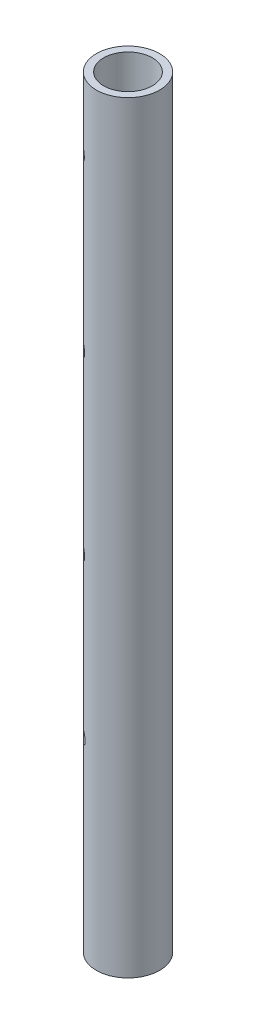
from build123d import *

# Parameters (mm, degrees)
SKETCH2_R                              = 16.51
BOSS_EXTRUDE1_DEPTH                    = 398.018
SKETCH3_R                              = 12.7
CUT_EXTRUDE1_DEPTH                     = 398.018
A_0_234_DIAMETER_HOLE1_REACH           = 365.847
A_0_234_DIAMETER_HOLE1_BORE_R          = 2.9718
A_0_234_DIAMETER_HOLE1_ON_FACE_2_REACH = 278.276
A_0_234_DIAMETER_HOLE1_BORE_2_R        = 2.9718
A_0_234_DIAMETER_HOLE1_ON_FACE_3_REACH = 303.949
A_0_234_DIAMETER_HOLE1_BORE_3_R        = 2.9718
N_0_302_DIAMETER_HOLE1_REACH           = 361.923
N_0_302_DIAMETER_HOLE1_BORE_R          = 3.81


with BuildPart() as part:
    # Sketch2 → Boss-Extrude1 (new body)
    with BuildSketch(Plane(origin=(0, 0, 0), x_dir=(1, 0, 0), z_dir=(0, 1, 0))):
        with Locations(Location((0, 0, 0), (0, 0, 270))):
            Circle(SKETCH2_R)
    extrude(amount=BOSS_EXTRUDE1_DEPTH)

    # Sketch3 → Cut-Extrude1 (cut)
    with BuildSketch(Plane.XZ):
        with Locations(Location((0, 0, 0), (0, 0, 270))):
            Circle(SKETCH3_R)
    extrude(amount=-CUT_EXTRUDE1_DEPTH, mode=Mode.SUBTRACT)

    # A (0.234) Diameter Hole1 bore (on position points) → A (0.234) Diameter Hole1 (cut, up to next)
    with BuildSketch(Plane(origin=(-11.22969926, 361.658078854, 12.10264246), x_dir=(0.733049210198, 0, 0.680175606317), z_dir=(-0.680175606317, 0, 0.733049210198)), mode=Mode.PRIVATE) as a_0_234_diameter_hole1_sk1:
        Circle(A_0_234_DIAMETER_HOLE1_BORE_R)
    a_0_234_diameter_hole1_tool1 = extrude(a_0_234_diameter_hole1_sk1.sketch, amount=-A_0_234_DIAMETER_HOLE1_REACH, mode=Mode.PRIVATE) & part.part
    add(a_0_234_diameter_hole1_tool1.solids().sort_by_distance((-11.229699, 361.658079, 12.102642))[0], mode=Mode.SUBTRACT)

    # A (0.234) Diameter Hole1 bore 2 (on position points) → A (0.234) Diameter Hole1 on face 2 (cut, up to next)
    with BuildSketch(Plane(origin=(-10.768707034, 273.389318793, 12.514593434), x_dir=(0.75800069812, 0, 0.652253740234), z_dir=(-0.652253740234, 0, 0.75800069812)), mode=Mode.PRIVATE) as a_0_234_diameter_hole1_on_face_2_sk1:
        Circle(A_0_234_DIAMETER_HOLE1_BORE_2_R)
    a_0_234_diameter_hole1_on_face_2_tool1 = extrude(a_0_234_diameter_hole1_on_face_2_sk1.sketch, amount=-A_0_234_DIAMETER_HOLE1_ON_FACE_2_REACH, mode=Mode.PRIVATE) & part.part
    # A (0.234) Diameter Hole1 bore 2 (on position points) → A (0.234) Diameter Hole1 on face 2 (cut, up to next)
    with BuildSketch(Plane(origin=(-10.768707034, 273.389318793, 12.514593434), x_dir=(0.75800069812, 0, 0.652253740234), z_dir=(-0.652253740234, 0, 0.75800069812)), mode=Mode.PRIVATE) as a_0_234_diameter_hole1_on_face_2_sk2:
        with Locations((0, -91.9723444)):
            Circle(A_0_234_DIAMETER_HOLE1_BORE_2_R)
    a_0_234_diameter_hole1_on_face_2_tool2 = extrude(a_0_234_diameter_hole1_on_face_2_sk2.sketch, amount=-A_0_234_DIAMETER_HOLE1_ON_FACE_2_REACH, mode=Mode.PRIVATE) & part.part
    add(a_0_234_diameter_hole1_on_face_2_tool1.solids().sort_by_distance((-10.768707, 273.389319, 12.514593))[0], mode=Mode.SUBTRACT)
    add(a_0_234_diameter_hole1_on_face_2_tool2.solids().sort_by_distance((-10.768707, 181.416974, 12.514593))[0], mode=Mode.SUBTRACT)

    # A (0.234) Diameter Hole1 bore 3 (on position points) → A (0.234) Diameter Hole1 on face 3 (cut, up to next)
    with BuildSketch(Plane(origin=(-10.291252546, 98.70359084, 12.910082147), x_dir=(0.781955431021, 0, 0.623334343588), z_dir=(-0.623334343588, 0, 0.781955431021)), mode=Mode.PRIVATE) as a_0_234_diameter_hole1_on_face_3_sk1:
        Circle(A_0_234_DIAMETER_HOLE1_BORE_3_R)
    a_0_234_diameter_hole1_on_face_3_tool1 = extrude(a_0_234_diameter_hole1_on_face_3_sk1.sketch, amount=-A_0_234_DIAMETER_HOLE1_ON_FACE_3_REACH, mode=Mode.PRIVATE) & part.part
    add(a_0_234_diameter_hole1_on_face_3_tool1.solids().sort_by_distance((-10.291253, 98.703591, 12.910082))[0], mode=Mode.SUBTRACT)

    # N (0.302) Diameter Hole1 bore (on position points) → N (0.302) Diameter Hole1 (cut, up to next)
    with BuildSketch(Plane(origin=(-5.417804763, 40.200816881, -15.595752356), x_dir=(-0.944624612714, 0, 0.328152923277), z_dir=(-0.328152923277, 0, -0.944624612714)), mode=Mode.PRIVATE) as n_0_302_diameter_hole1_sk1:
        Circle(N_0_302_DIAMETER_HOLE1_BORE_R)
    n_0_302_diameter_hole1_tool1 = extrude(n_0_302_diameter_hole1_sk1.sketch, amount=-N_0_302_DIAMETER_HOLE1_REACH, mode=Mode.PRIVATE) & part.part
    add(n_0_302_diameter_hole1_tool1.solids().sort_by_distance((-5.417805, 40.200817, -15.595752))[0], mode=Mode.SUBTRACT)


solid = part.part
